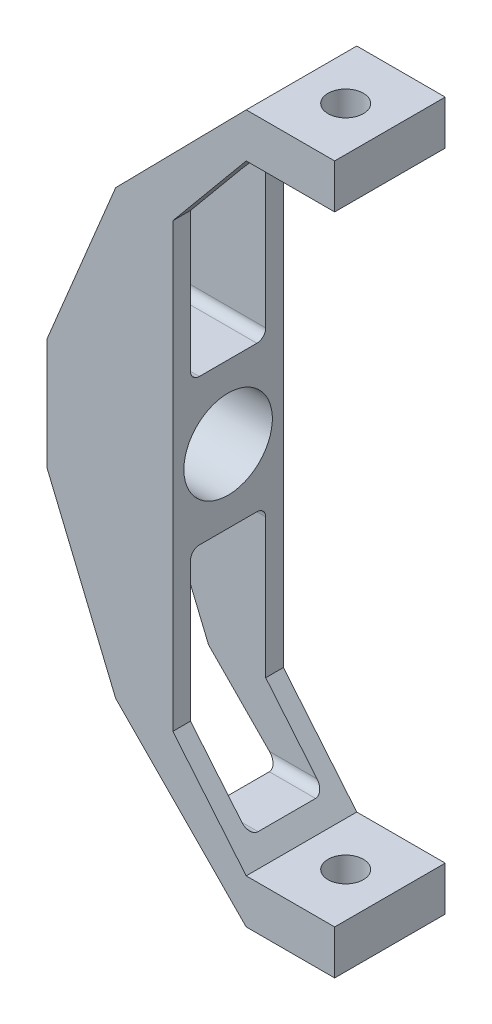
from build123d import *

# Parameters (mm, degrees)
BOSS_EXTRUDE1_DEPTH = 25
SKETCH3_R           = 10
CUT_EXTRUDE2_DEPTH  = 175.532828144
SKETCH4_R           = 4
CUT_EXTRUDE3_DEPTH  = 175.532828144


with BuildPart() as part:
    # Sketch1 → Boss-Extrude1 (new body)
    with BuildSketch(Plane.XY):
        Polygon((0, 0), (-20, 0), (-49.518324122, -30), (-65.09, -67.5), (-65.09, -92.5), (-49.518324122, -130), (-20, -160), (0, -160), (0, -150), (-20, -150), (-36.59, -130), (-36.59, -30), (-20, -10), (0, -10), align=None)
    extrude(amount=BOSS_EXTRUDE1_DEPTH)

    # Sketch3 → Cut-Extrude2 (cut, through all)
    with BuildSketch(Plane.ZY.offset(65.09)):
        with Locations((12.5, -80)):
            Circle(SKETCH3_R)
        with BuildLine():
            Line((6, -63.5), (19, -63.5))
            ThreePointArc((19, -63.5), (20.414213562, -62.914213562), (21, -61.5))
            Line((21, -61.5), (21, -15.999055713))
            ThreePointArc((21, -15.999055713), (20.414213562, -14.584842151), (19, -13.999055713))
            Line((19, -13.999055713), (6, -13.999055713))
            ThreePointArc((6, -13.999055713), (4.585786438, -14.584842151), (4, -15.999055713))
            Line((4, -15.999055713), (4, -61.5))
            ThreePointArc((4, -61.5), (4.585786438, -62.914213562), (6, -63.5))
        make_face()
        with BuildLine():
            Line((6, -146.000944287), (19, -146.000944287))
            ThreePointArc((19, -146.000944287), (20.414213562, -145.415157849), (21, -144.000944287))
            Line((21, -144.000944287), (21, -98.5))
            ThreePointArc((21, -98.5), (20.414213562, -97.085786438), (19, -96.5))
            Line((19, -96.5), (6, -96.5))
            ThreePointArc((6, -96.5), (4.585786438, -97.085786438), (4, -98.5))
            Line((4, -98.5), (4, -144.000944287))
            ThreePointArc((4, -144.000944287), (4.585786438, -145.415157849), (6, -146.000944287))
        make_face()
    extrude(amount=-CUT_EXTRUDE2_DEPTH, mode=Mode.SUBTRACT)

    # Sketch4 → Cut-Extrude3 (cut, through all)
    with BuildSketch(Plane(origin=(0, 0, 0), x_dir=(1, 0, 0), z_dir=(0, 1, 0))):
        with Locations(Location((-10, -12.5, 0), (0, 0, 180))):
            Circle(SKETCH4_R)
    extrude(amount=-CUT_EXTRUDE3_DEPTH, mode=Mode.SUBTRACT)


solid = part.part
